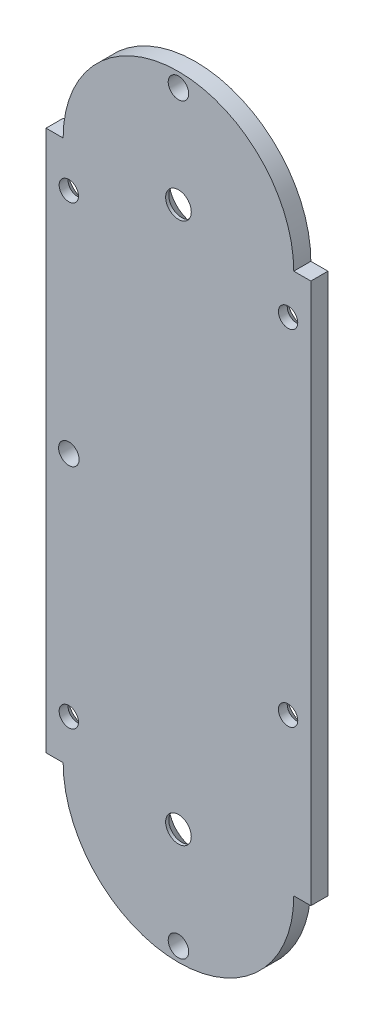
from build123d import *

# Parameters (mm, degrees)
ESTRUSIONE_ESTRUSIONE1_DEPTH          = 3
FORO_SVASATO_PER_VITE_M4_1_AT_2_COUNT = 2
FORO_SVASATO_PER_VITE_M4_1_AT_2_PITCH = 95
FORO_SVASATO_PER_VITE_M3_1_AT_2_COUNT = 2
FORO_SVASATO_PER_VITE_M3_1_AT_2_PITCH = 60.5
FORO_SVASATO_PER_VITE_M3_1_AT_3_COUNT = 2
FORO_SVASATO_PER_VITE_M3_1_AT_3_PITCH = 88.782036471
FORO_SVASATO_PER_VITE_M3_1_AT_4_COUNT = 2
FORO_SVASATO_PER_VITE_M3_1_AT_4_PITCH = 38.5
M3_CLEARANCE_HOLE1_D                  = 3.6
M3_CLEARANCE_HOLE1_DEPTH              = 4
M3_CLEARANCE_HOLE1_TIP                = 1.081549114


with BuildPart() as part:
    # Schizzo1 → Estrusione-Estrusione1 (new body)
    with BuildSketch(Plane.XY):
        with BuildLine():
            Line((20.25, -47.5), (23.25, -47.5))
            Line((23.25, -47.5), (23.25, 47.5))
            Line((23.25, 47.5), (20.25, 47.5))
            ThreePointArc((20.25, 47.5), (0, 67.75), (-20.25, 47.5))
            Line((-20.25, 47.5), (-23.25, 47.5))
            Line((-23.25, 47.5), (-23.25, -47.5))
            Line((-23.25, -47.5), (-20.25, -47.5))
            ThreePointArc((-20.25, -47.5), (0, -67.75), (20.25, -47.5))
        make_face()
    extrude(amount=ESTRUSIONE_ESTRUSIONE1_DEPTH)

    # Schizzo5 → Foro svasato per Vite M4-1 (revolve, cut)
    with BuildSketch(Plane(origin=(0, 47.5, 0), x_dir=(0, 1, 0), z_dir=(1, 0, 0))):
        Polygon((0, 0), (0, 3), (2.25, 3), (2.25, 2.45), (4.7, 0), align=None)
    foro_svasato_per_vite_m4_1 = revolve(axis=Axis((0, 47.5, -6.35), (0, 0, 1)), mode=Mode.SUBTRACT)

    # Foro svasato per Vite M4-1 at 2: Foro svasato per Vite M4-1 ×2
    with Locations(*[(0, -i * FORO_SVASATO_PER_VITE_M4_1_AT_2_PITCH, 0) for i in range(1, FORO_SVASATO_PER_VITE_M4_1_AT_2_COUNT)]):
        add(foro_svasato_per_vite_m4_1, mode=Mode.SUBTRACT)

    # Schizzo8 → Foro svasato per Vite M3-1 (revolve, cut)
    with BuildSketch(Plane(origin=(19.25, 40, 0), x_dir=(0, 1, 0), z_dir=(1, 0, 0))):
        Polygon((0, 0), (0, 3), (1.7, 3), (1.7, 1.45), (3.15, 0), align=None)
    foro_svasato_per_vite_m3_1 = revolve(axis=Axis((19.25, 40, -6.35), (0, 0, 1)), mode=Mode.SUBTRACT)

    # Foro svasato per Vite M3-1 at 2: Foro svasato per Vite M3-1 ×2
    with Locations(*[(0, -i * FORO_SVASATO_PER_VITE_M3_1_AT_2_PITCH, 0) for i in range(1, FORO_SVASATO_PER_VITE_M3_1_AT_2_COUNT)]):
        add(foro_svasato_per_vite_m3_1, mode=Mode.SUBTRACT)

    # Foro svasato per Vite M3-1 at 3: Foro svasato per Vite M3-1 ×2
    with Locations(*[Vector(-0.43364628172754605, -0.9010831828104849, 0) * (i * FORO_SVASATO_PER_VITE_M3_1_AT_3_PITCH) for i in range(1, FORO_SVASATO_PER_VITE_M3_1_AT_3_COUNT)]):
        add(foro_svasato_per_vite_m3_1, mode=Mode.SUBTRACT)

    # Foro svasato per Vite M3-1 at 4: Foro svasato per Vite M3-1 ×2
    with Locations(*[(-i * FORO_SVASATO_PER_VITE_M3_1_AT_4_PITCH, 0, 0) for i in range(1, FORO_SVASATO_PER_VITE_M3_1_AT_4_COUNT)]):
        add(foro_svasato_per_vite_m3_1, mode=Mode.SUBTRACT)

    # M3 Clearance Hole1
    with Locations(Plane(origin=(0, 0, 0), x_dir=(-1, 0, 0), z_dir=(0, 0, -1))):
        with Locations((19.25, 0), (0, 65.25), (0, -65.25)):
            Hole(M3_CLEARANCE_HOLE1_D / 2, depth=M3_CLEARANCE_HOLE1_DEPTH)
            with Locations((0, 0, -(M3_CLEARANCE_HOLE1_DEPTH + M3_CLEARANCE_HOLE1_TIP / 2))):  # 118° drill point
                Cone(0, M3_CLEARANCE_HOLE1_D / 2, M3_CLEARANCE_HOLE1_TIP, mode=Mode.SUBTRACT)


solid = part.part
